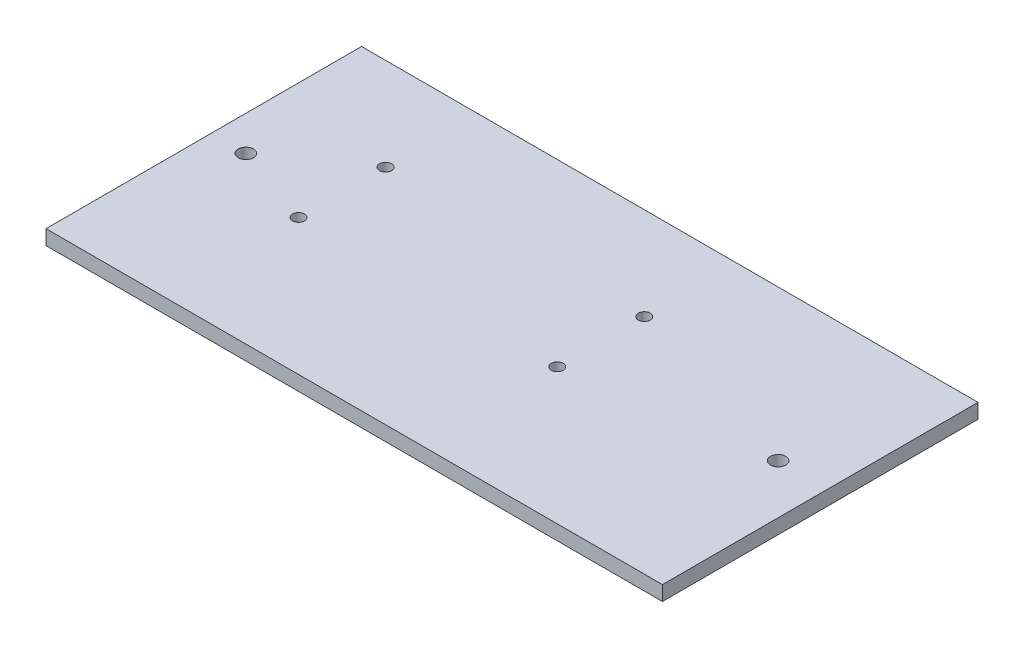
from build123d import *

# Parameters (mm, degrees)
SKETCH1_W           = 133.175
SKETCH1_H           = 68.175
SKETCH1_R           = 1.65
BOSS_EXTRUDE1_DEPTH = 3.175
SKETCH2_R           = 1.3
CUT_EXTRUDE1_DEPTH  = 3.175


with BuildPart() as part:
    # Sketch1 → Boss-Extrude1 (new body)
    with BuildSketch(Plane(origin=(0, 0, 0), x_dir=(1, 0, 0), z_dir=(0, 1, 0))):
        Rectangle(SKETCH1_W, SKETCH1_H)
        with Locations(Location((-59.0875, 1.5875, 0), (0, 0, 270))):
            Circle(SKETCH1_R, mode=Mode.SUBTRACT)
        with Locations(Location((55.9125, 1.5875, 0), (0, 0, 270))):
            Circle(SKETCH1_R, mode=Mode.SUBTRACT)
    extrude(amount=BOSS_EXTRUDE1_DEPTH)

    # Sketch2 → Cut-Extrude1 (cut)
    with BuildSketch(Plane(origin=(0, 3.175, 0), x_dir=(1, 0, 0), z_dir=(0, 1, 0))):
        with Locations(Location((14.4875, -4.7125, 0), (0, 0, 270))):
            Circle(SKETCH2_R)
        with Locations(Location((-41.4125, -4.7125, 0), (0, 0, 270))):
            Circle(SKETCH2_R)
        with Locations(Location((-41.4125, 14.0875, 0), (0, 0, 270))):
            Circle(SKETCH2_R)
        with Locations(Location((14.4875, 14.0875, 0), (0, 0, 270))):
            Circle(SKETCH2_R)
    extrude(amount=-CUT_EXTRUDE1_DEPTH, mode=Mode.SUBTRACT)


solid = part.part
